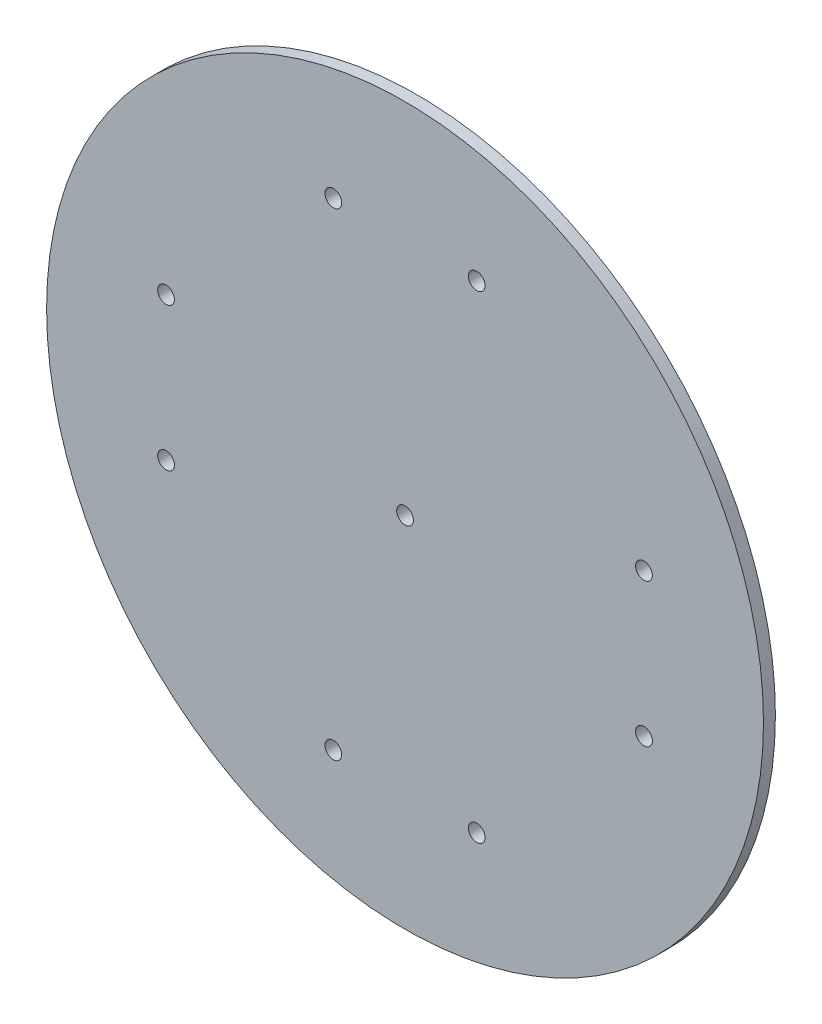
from build123d import *

# Parameters (mm, degrees)
SKETCH1_R           = 75
BOSS_EXTRUDE1_DEPTH = 2.5
SKETCH2_R           = 1.75
CUT_EXTRUDE1_DEPTH  = 107.09547587
SKETCH3_R           = 1.75
CUT_EXTRUDE2_DEPTH  = 107.09547587


with BuildPart() as part:
    # Sketch1 → Boss-Extrude1 (new body)
    with BuildSketch(Plane.XY):
        Circle(SKETCH1_R)
    extrude(amount=BOSS_EXTRUDE1_DEPTH)

    # Sketch2 → Cut-Extrude1 (cut, through all)
    with BuildSketch(Plane(origin=(0, 0, 0), x_dir=(-1, 0, 0), z_dir=(0, 0, -1))):
        with Locations((-50, 15)):
            Circle(SKETCH2_R)
        with Locations((-50, -15)):
            Circle(SKETCH2_R)
        with Locations((-15, -50)):
            Circle(SKETCH2_R)
        with Locations((15, -50)):
            Circle(SKETCH2_R)
        with Locations((50, -15)):
            Circle(SKETCH2_R)
        with Locations((50, 15)):
            Circle(SKETCH2_R)
        with Locations((-15, 50)):
            Circle(SKETCH2_R)
        with Locations((15, 50)):
            Circle(SKETCH2_R)
    extrude(amount=-CUT_EXTRUDE1_DEPTH, mode=Mode.SUBTRACT)

    # Sketch3 → Cut-Extrude2 (cut, through all)
    with BuildSketch(Plane(origin=(0, 0, 0), x_dir=(-1, 0, 0), z_dir=(0, 0, -1))):
        Circle(SKETCH3_R)
    extrude(amount=-CUT_EXTRUDE2_DEPTH, mode=Mode.SUBTRACT)


solid = part.part
